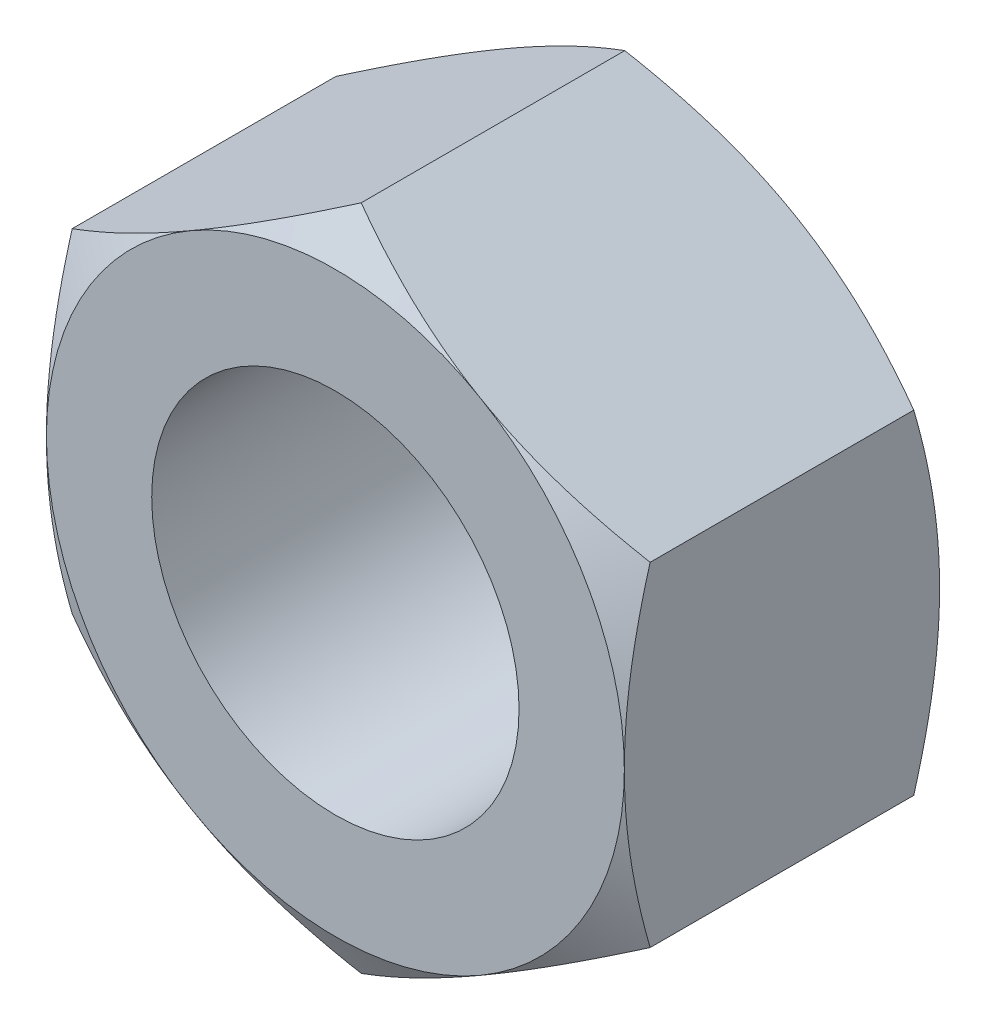
from build123d import *

# Parameters (mm, degrees)
SKETCH1_R               = 5.5499
EXTRUDE1_DEPTH          = 4.7625
SKETCH7_OUTSIDE_W       = 113.114
SKETCH7_OUTSIDE_H       = 115.816
SKETCH7_OUTSIDE_R       = 8.73125
EXTRUDE2_DEPTH          = 25.4
EXTRUDE2_DRAFT          = -60
MIRROR1_COPY_1_SKETCH_W = 113.114
MIRROR1_COPY_1_SKETCH_H = 115.816
MIRROR1_COPY_1_SKETCH_R = 8.73125
MIRROR1_COPY_1_DEPTH    = 25.4
MIRROR1_COPY_1_DRAFT    = -60


with BuildPart() as part:
    # Sketch1 → Extrude1 (new, symmetric)
    with BuildSketch(Plane.XY):
        Polygon((-8.73125, 5.040989538), (-8.73125, -5.040989538), (0, -10.081979076), (8.73125, -5.040989538), (8.73125, 5.040989538), (0, 10.081979076), align=None)
        Circle(SKETCH1_R, mode=Mode.SUBTRACT)
    extrude(amount=EXTRUDE1_DEPTH, both=True)


with BuildPart() as extrude2_tool:
    # Sketch7 outside → Extrude2 (with draft: the straight prism first)
    with BuildSketch(Plane.XY.offset(4.7625)):
        Rectangle(SKETCH7_OUTSIDE_W, SKETCH7_OUTSIDE_H)
        Circle(SKETCH7_OUTSIDE_R, mode=Mode.SUBTRACT)
    extrude(amount=-EXTRUDE2_DEPTH)
    # Extrude2: the draft: its side faces are tilted about the plane it starts from
    extrude2_sides = [extrude2_tool.faces().sort_by_distance(p)[0] for p in [
        (0, -57.908, -7.9375),
        (56.557, 0, -7.9375),
        (0, 57.908, -7.9375),
        (-56.557, 0, -7.9375),
        (-8.73125, 0, -7.9375),
    ]]
    draft(extrude2_sides, Plane.XY.offset(4.7625), EXTRUDE2_DRAFT)


with BuildPart() as part_1:
    add(part.part)

    # Extrude2: cut by extrude2_tool
    add(extrude2_tool.part, mode=Mode.SUBTRACT)


with BuildPart() as mirror1_copy_1_tool:
    # Mirror1 copy 1 sketch → Mirror1 copy 1 (with draft: the straight prism first)
    with BuildSketch(Plane(origin=(0, 0, -4.7625), x_dir=(1, 0, 0), z_dir=(0, 0, -1))):
        Rectangle(MIRROR1_COPY_1_SKETCH_W, MIRROR1_COPY_1_SKETCH_H)
        Circle(MIRROR1_COPY_1_SKETCH_R, mode=Mode.SUBTRACT)
    extrude(amount=-MIRROR1_COPY_1_DEPTH)
    # Mirror1 copy 1: the draft: its side faces are tilted about the plane it starts from
    mirror1_copy_1_sides = [mirror1_copy_1_tool.faces().sort_by_distance(p)[0] for p in [
        (0, -57.908, 7.9375),
        (56.557, 0, 7.9375),
        (0, 57.908, 7.9375),
        (-56.557, 0, 7.9375),
        (-8.73125, 0, 7.9375),
    ]]
    draft(mirror1_copy_1_sides, Plane(origin=(0, 0, -4.7625), x_dir=(1, 0, 0), z_dir=(0, 0, -1)), MIRROR1_COPY_1_DRAFT)


with BuildPart() as part_2:
    add(part_1.part)

    # Mirror1 copy 1: cut by mirror1_copy_1_tool
    add(mirror1_copy_1_tool.part, mode=Mode.SUBTRACT)


solid = part_2.part
